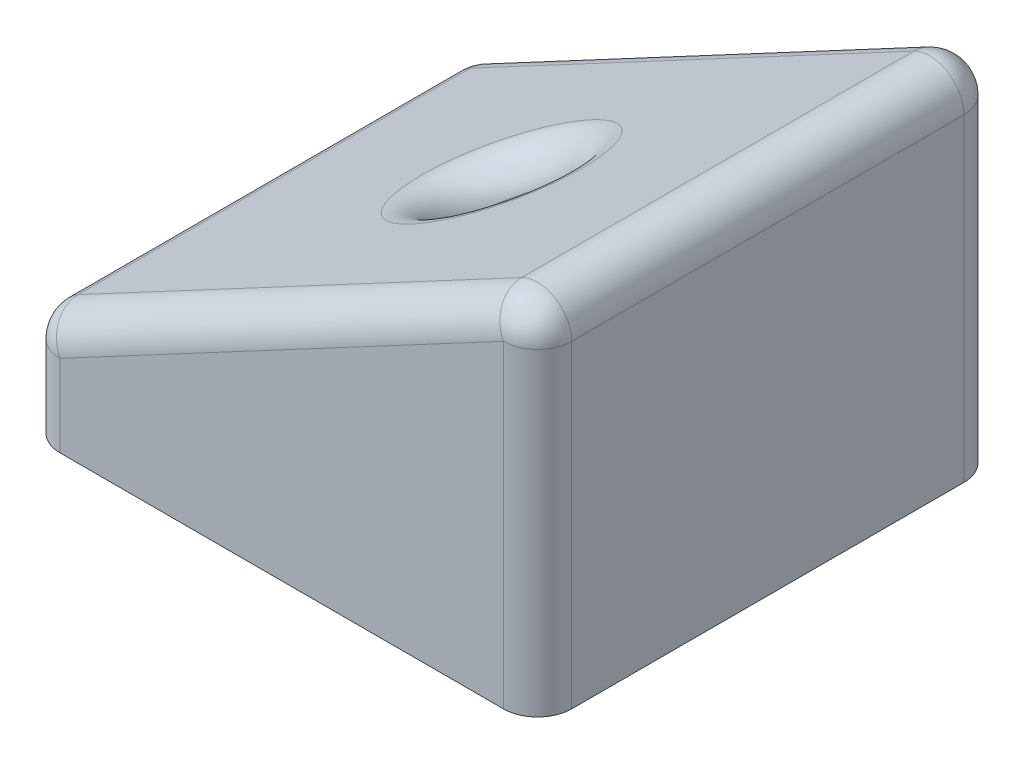
from build123d import *

# Parameters (mm, degrees)
SKETCH1_W           = 30
SKETCH1_H           = 27
BOSS_EXTRUDE1_DEPTH = 22
CUT_EXTRUDE1_DEPTH  = 46.967379738
CUT_EXTRUDE2_DEPTH  = 46.66149711
SKETCH4_R           = 6.960577045
SKETCH4_R_2         = 3.3
BOSS_EXTRUDE2_DEPTH = 8
FILLET2_R           = 2


with BuildPart() as part:
    # Sketch1 → Boss-Extrude1 (new body)
    with BuildSketch(Plane(origin=(0, 0, 0), x_dir=(1, 0, 0), z_dir=(0, 1, 0))):
        with Locations((15, -13.5)):
            Rectangle(SKETCH1_W, SKETCH1_H)
    extrude(amount=BOSS_EXTRUDE1_DEPTH)

    # Sketch2 → Cut-Extrude1 (cut, through all)
    with BuildSketch(Plane.XY.offset(27)):
        Polygon((0, 6), (0, 22), (30, 22), align=None)
    extrude(amount=-CUT_EXTRUDE1_DEPTH, mode=Mode.SUBTRACT)

    # Sketch3 → Cut-Extrude2 (cut, through all)
    with BuildSketch(Plane(origin=(-2.491349481, 4.671280277, 0), x_dir=(0.8823529411764706, 0.47058823529411764, 0), z_dir=(-0.47058823529411764, 0.8823529411764706, 0))):
        Polygon((22.394089302, -19.014916182), (25.627250808, -13.414916183), (22.394089302, -7.814916185), (19.036531329, -7.814916185), (15.678973356, -7.814916185), (12.445811849, -13.414916183), (15.678973356, -19.014916182), (19.036531329, -19.014916182), align=None)
    extrude(amount=-CUT_EXTRUDE2_DEPTH, mode=Mode.SUBTRACT)

    # Sketch4 → Boss-Extrude2 (add)
    with BuildSketch(Plane(origin=(-2.491349481, 4.671280277, 0), x_dir=(0.8823529411764706, 0.47058823529411764, 0), z_dir=(-0.47058823529411764, 0.8823529411764706, 0))):
        with Locations((19.036531329, -13.414916183)):
            Circle(SKETCH4_R)
        with Locations(Location((19.036531329, -13.414916183, 0), (0, 0, 180))):
            Circle(SKETCH4_R_2, mode=Mode.SUBTRACT)
    extrude(amount=-BOSS_EXTRUDE2_DEPTH)

    # Fillet2
    fillet2_edges = [part.edges().sort_by_distance(p)[0] for p in [
        (30, 22, 13.5),
        (0, 3, 0),
        (0, 3, 27),
        (15, 14, 0),
        (0, 6, 13.5),
        (15, 14, 27),
        (17.217354633, 15.182589137, 13.414916183),
        (30, 11, 0),
        (30, 11, 27),
    ]]
    fillet(fillet2_edges, radius=FILLET2_R)


solid = part.part
